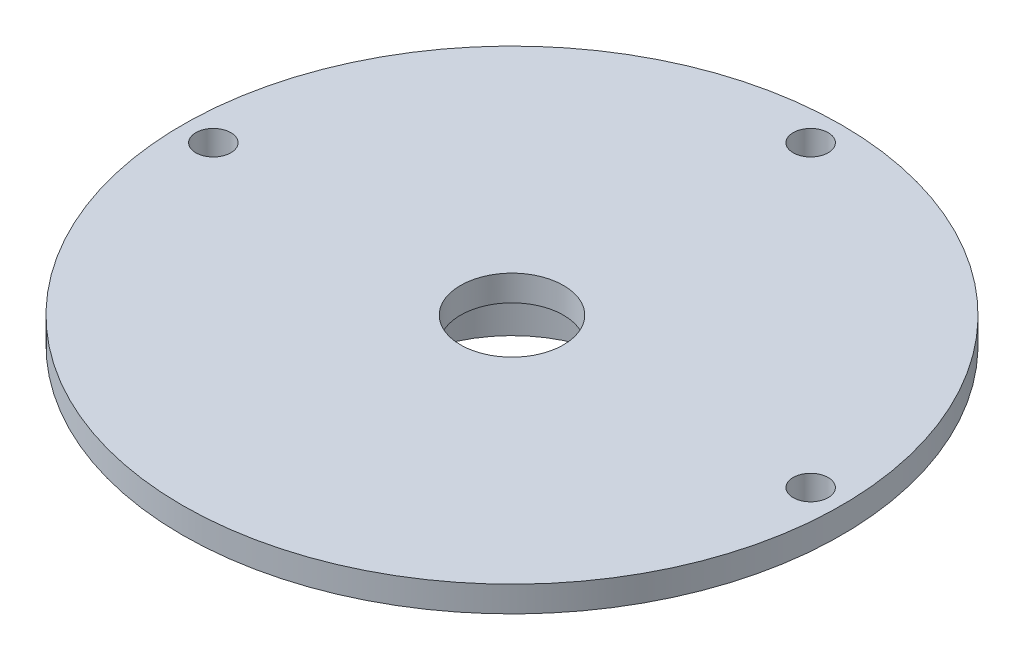
from build123d import *

# Parameters (mm, degrees)
CROQUIS1_R              = 32
CROQUIS1_R_2            = 1.7
SALIENTE_EXTRUIR1_DEPTH = 2.5
CROQUIS2_R              = 16
CROQUIS2_R_2            = 11
SALIENTE_EXTRUIR2_DEPTH = 7
CROQUIS3_R              = 5
CORTAR_EXTRUIR1_DEPTH   = 7


with BuildPart() as part:
    # Croquis1 → Saliente-Extruir1 (new body)
    with BuildSketch(Plane(origin=(0, 0, 0), x_dir=(1, 0, 0), z_dir=(0, 1, 0))):
        with Locations(Location((0, 0, 0), (0, 0, 270))):
            Circle(CROQUIS1_R)
        with Locations(Location((29, 0, 0), (0, 0, 270))):
            Circle(CROQUIS1_R_2, mode=Mode.SUBTRACT)
        with Locations(Location((-29, 0, 0), (0, 0, 270))):
            Circle(CROQUIS1_R_2, mode=Mode.SUBTRACT)
        with Locations(Location((0, 29, 0), (0, 0, 270))):
            Circle(CROQUIS1_R_2, mode=Mode.SUBTRACT)
    extrude(amount=SALIENTE_EXTRUIR1_DEPTH)

    # Croquis2 → Saliente-Extruir2 (add)
    with BuildSketch(Plane.XZ):
        with Locations(Location((0, 0, 0), (0, 0, 90))):
            Circle(CROQUIS2_R)
        with Locations(Location((0, 0, 0), (0, 0, 270))):
            Circle(CROQUIS2_R_2, mode=Mode.SUBTRACT)
    extrude(amount=SALIENTE_EXTRUIR2_DEPTH)

    # Croquis3 → Cortar-Extruir1 (cut)
    with BuildSketch(Plane.XZ):
        with Locations(Location((0, 0, 0), (0, 0, 270))):
            Circle(CROQUIS3_R)
    extrude(amount=-CORTAR_EXTRUIR1_DEPTH, mode=Mode.SUBTRACT)


solid = part.part
